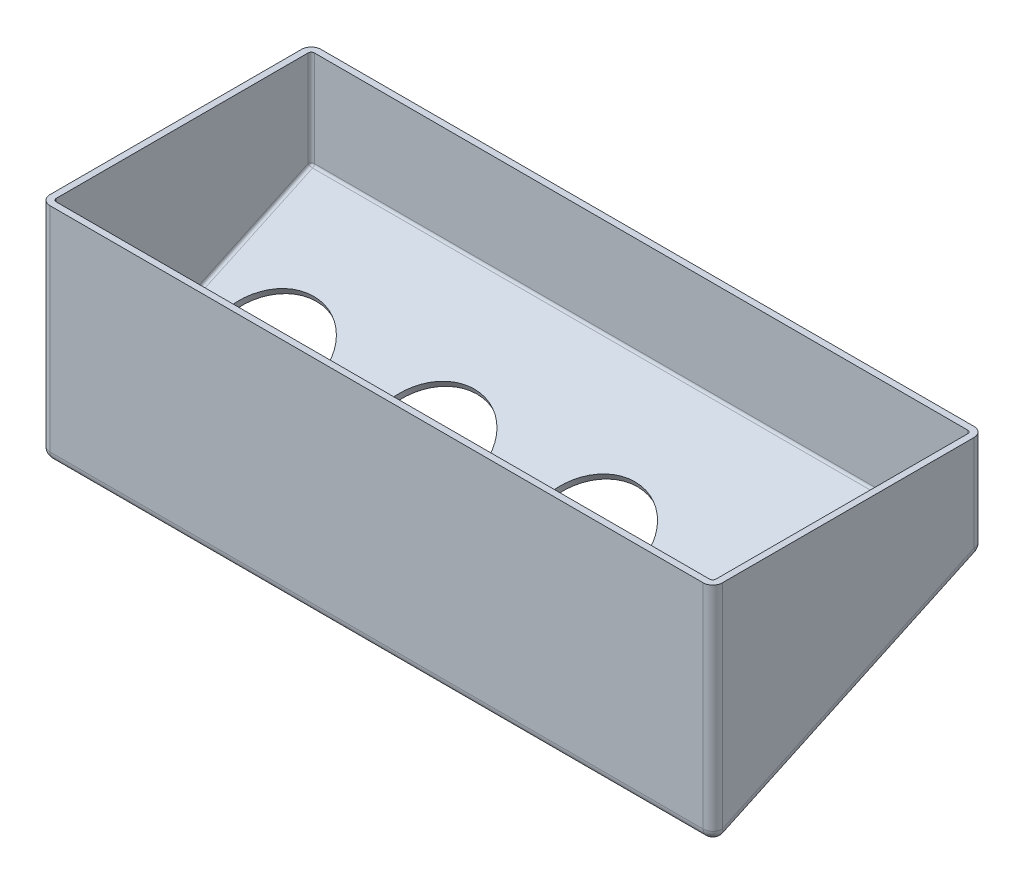
from build123d import *

# Parameters (mm, degrees)
BOSS_EXTRUDE1_DEPTH = 167.4876
FILLET1_R           = 4.7625
SHELL2_T            = -3.175
SKETCH2_R           = 25.4
CUT_EXTRUDE1_DEPTH  = 7.62


with BuildPart() as part:
    # Sketch1 → Boss-Extrude1 (new, symmetric)
    with BuildSketch(Plane(origin=(0, 0, 0), x_dir=(0, 0, -1), z_dir=(1, 0, 0))):
        Polygon((0, 0), (134.9502, 62.92831173), (134.9502, 113.72831173), (0, 113.72831173), align=None)
    extrude(amount=BOSS_EXTRUDE1_DEPTH, both=True)

    # Fillet1
    fillet1_edges = [part.edges().sort_by_distance(p)[0] for p in [
        (167.4876, 56.864155865, 0),
        (167.4876, 31.464155865, -67.4751),
        (167.4876, 88.32831173, -134.9502),
        (-167.4876, 31.464155865, -67.4751),
        (-167.4876, 56.864155865, 0),
        (-167.4876, 88.32831173, -134.9502),
        (0, 62.92831173, -134.9502),
        (0, 0, 0),
    ]]
    fillet(fillet1_edges, radius=FILLET1_R)

    # Shell2
    shell2_openings = [part.faces().sort_by_distance(p)[0] for p in [
        (0, 113.72831173, -67.4751),
    ]]
    offset(amount=SHELL2_T, openings=shell2_openings, kind=Kind.INTERSECTION)

    # Sketch2 → Cut-Extrude1 (cut)
    with BuildSketch(Plane(origin=(0, 0, 0), x_dir=(1, 0, 0), z_dir=(0, -0.9063077870366493, -0.422618261740701))):
        with Locations(Location((-124.5824, -79.05107084, 0), (0, 0, 270))):
            Circle(SKETCH2_R)
        with Locations(Location((-44.5824, -79.05107084, 0), (0, 0, 270))):
            Circle(SKETCH2_R)
        with Locations(Location((35.4176, -79.05107084, 0), (0, 0, 270))):
            Circle(SKETCH2_R)
        with Locations(Location((115.4176, -79.05107084, 0), (0, 0, 270))):
            Circle(SKETCH2_R)
    extrude(amount=-CUT_EXTRUDE1_DEPTH, mode=Mode.SUBTRACT)


solid = part.part
